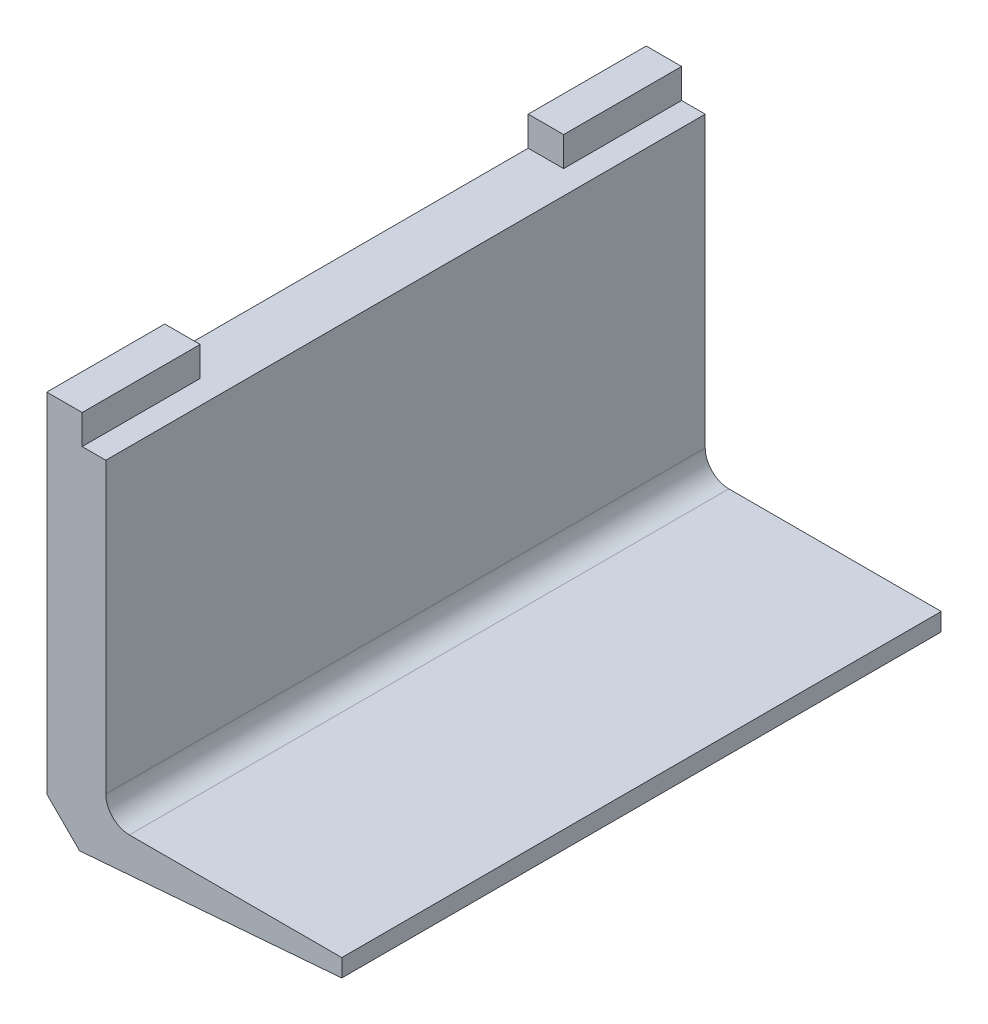
from build123d import *

# Parameters (mm, degrees)
BOSS_EXTRUDE1_DEPTH = 101.6
CHAMFER1_SIZE       = 6
CHAMFER1_SIZE2      = 5.57330498
FILLET1_R           = 4
SKETCH2_W           = 6
SKETCH2_H           = 20
BOSS_EXTRUDE2_DEPTH = 5


with BuildPart() as part:
    # Sketch1 → Boss-Extrude1 (new body)
    with BuildSketch(Plane.XY):
        Polygon((-33.412698413, -41.573204241), (16.587301587, -37.573204241), (16.587301587, -34.573204241), (-23.412698413, -34.573204241), (-23.412698413, 18.426795759), (-33.412698413, 18.426795759), (-33.412698413, -33.573204241), align=None)
    extrude(amount=BOSS_EXTRUDE1_DEPTH)

    # Chamfer1
    chamfer1_edges = [part.edges().sort_by_distance(p)[0] for p in [
        (-33.412698413, -41.573204241, 50.8),
    ]]
    chamfer1_side = [part.faces().sort_by_distance(p)[0] for p in [
        (-33.412698413, -11.573204241, 50.8),
    ]]
    chamfer(chamfer1_edges, length=CHAMFER1_SIZE, length2=CHAMFER1_SIZE2, reference=chamfer1_side[0])

    # Fillet1
    fillet1_edges = [part.edges().sort_by_distance(p)[0] for p in [
        (-23.412698413, -34.573204241, 50.8),
    ]]
    fillet(fillet1_edges, radius=FILLET1_R)

    # Sketch2 → Boss-Extrude2 (add)
    with BuildSketch(Plane(origin=(0, 18.426795759, 0), x_dir=(1, 0, 0), z_dir=(0, 1, 0))):
        with Locations((-30.412698413, -91.6)):
            Rectangle(SKETCH2_W, SKETCH2_H)
        with Locations((-30.412698413, -10)):
            Rectangle(SKETCH2_W, SKETCH2_H)
    extrude(amount=BOSS_EXTRUDE2_DEPTH)


solid = part.part
